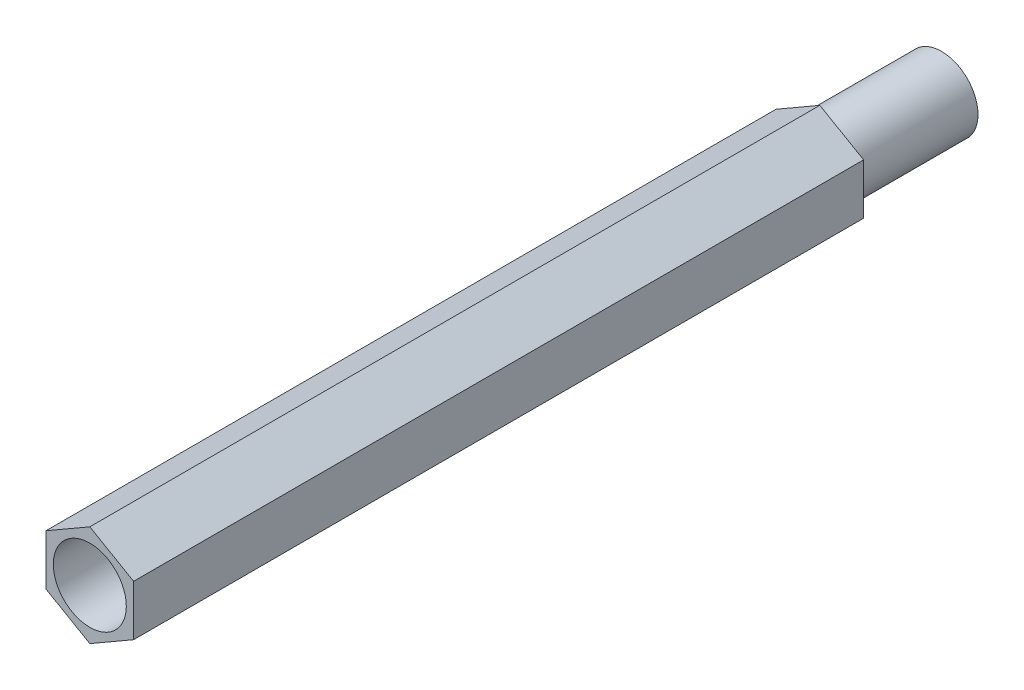
from build123d import *

# Parameters (mm, degrees)
SKETCH_1_R      = 1.5
EXTRUDE_1_DEPTH = 30
SKETCH_2_R      = 1.5
EXTRUDE_2_DEPTH = 5


with BuildPart() as part:
    # 草图1 → 凸台-拉伸1 (new body)
    with BuildSketch(Plane.XY):
        Polygon((0, 2.078460969), (-1.8, 1.039230485), (-1.8, -1.039230485), (0, -2.078460969), (1.8, -1.039230485), (1.8, 1.039230485), align=None)
        Circle(SKETCH_1_R, mode=Mode.SUBTRACT)
    extrude(amount=EXTRUDE_1_DEPTH)

    # 草图2 → 凸台-拉伸2 (add, symmetric)
    with BuildSketch(Plane(origin=(0, 0, 0), x_dir=(-1, 0, 0), z_dir=(0, 0, -1))):
        Circle(SKETCH_2_R)
    extrude(amount=EXTRUDE_2_DEPTH, both=True)


solid = part.part
